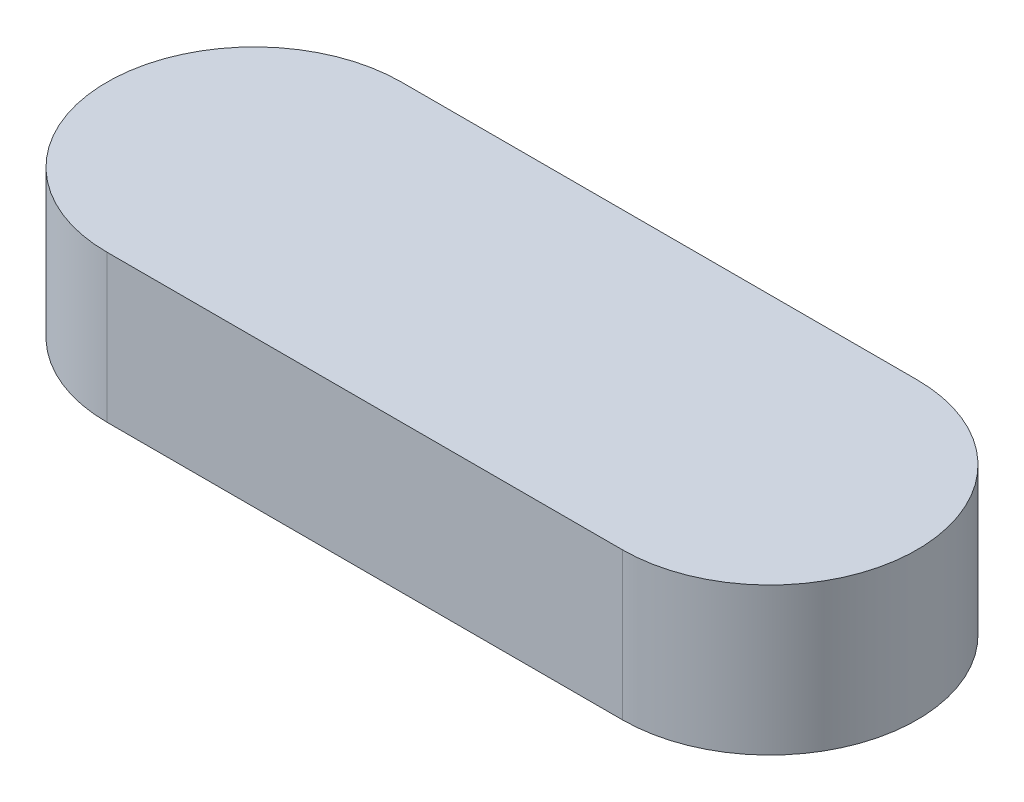
from build123d import *

# Parameters (mm, degrees)
SALIENTE_EXTRUIR1_DEPTH = 100


with BuildPart() as part:
    # Croquis1 → Saliente-Extruir1 (new body)
    with BuildSketch(Plane(origin=(0, 0, 0), x_dir=(1, 0, 0), z_dir=(0, 1, 0))):
        with BuildLine():
            Line((0, -100), (-350, -100))
            ThreePointArc((-350, -100), (-450, 0), (-350, 100))
            Line((-350, 100), (0, 100))
            ThreePointArc((0, 100), (100, 0), (0, -100))
        make_face()
    extrude(amount=SALIENTE_EXTRUIR1_DEPTH)


solid = part.part
